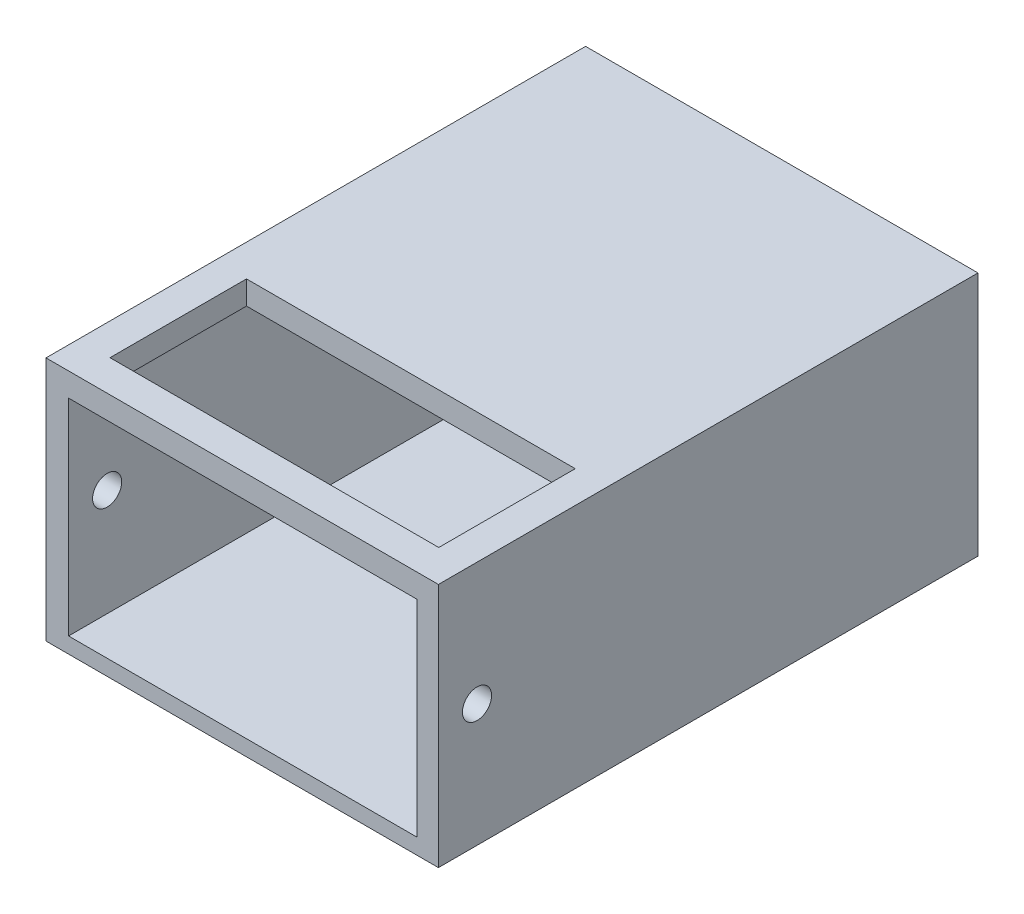
from build123d import *

# Parameters (mm, degrees)
SKETCH1_W           = 40
SKETCH1_H           = 55
BOSS_EXTRUDE1_DEPTH = 25
SKETCH2_W           = 35.5
SKETCH2_H           = 21
CUT_EXTRUDE1_DEPTH  = 52.5
SKETCH3_R           = 1.485145447
CUT_EXTRUDE2_DEPTH  = 52.5
SKETCH5_W           = 33.510072246
SKETCH5_H           = 13.913042654
CUT_EXTRUDE3_DEPTH  = 20


with BuildPart() as part:
    # Sketch1 → Boss-Extrude1 (new body)
    with BuildSketch(Plane(origin=(0, 0, 0), x_dir=(1, 0, 0), z_dir=(0, 1, 0))):
        Rectangle(SKETCH1_W, SKETCH1_H)
    extrude(amount=BOSS_EXTRUDE1_DEPTH)

    # Sketch2 → Cut-Extrude1 (cut)
    with BuildSketch(Plane.XY.offset(27.5)):
        with Locations((0.05, 12.1)):
            Rectangle(SKETCH2_W, SKETCH2_H)
    extrude(amount=-CUT_EXTRUDE1_DEPTH, mode=Mode.SUBTRACT)

    # Sketch3 → Cut-Extrude2 (cut)
    with BuildSketch(Plane.ZY.offset(20)):
        with Locations((23.566951269, 12.5)):
            Circle(SKETCH3_R)
    extrude(amount=-CUT_EXTRUDE2_DEPTH, mode=Mode.SUBTRACT)

    # Sketch5 → Cut-Extrude3 (cut)
    with BuildSketch(Plane(origin=(0, 25, 0), x_dir=(1, 0, 0), z_dir=(0, 1, 0))):
        with Locations((0, -17.264049878)):
            Rectangle(SKETCH5_W, SKETCH5_H)
    extrude(amount=-CUT_EXTRUDE3_DEPTH, mode=Mode.SUBTRACT)


solid = part.part
